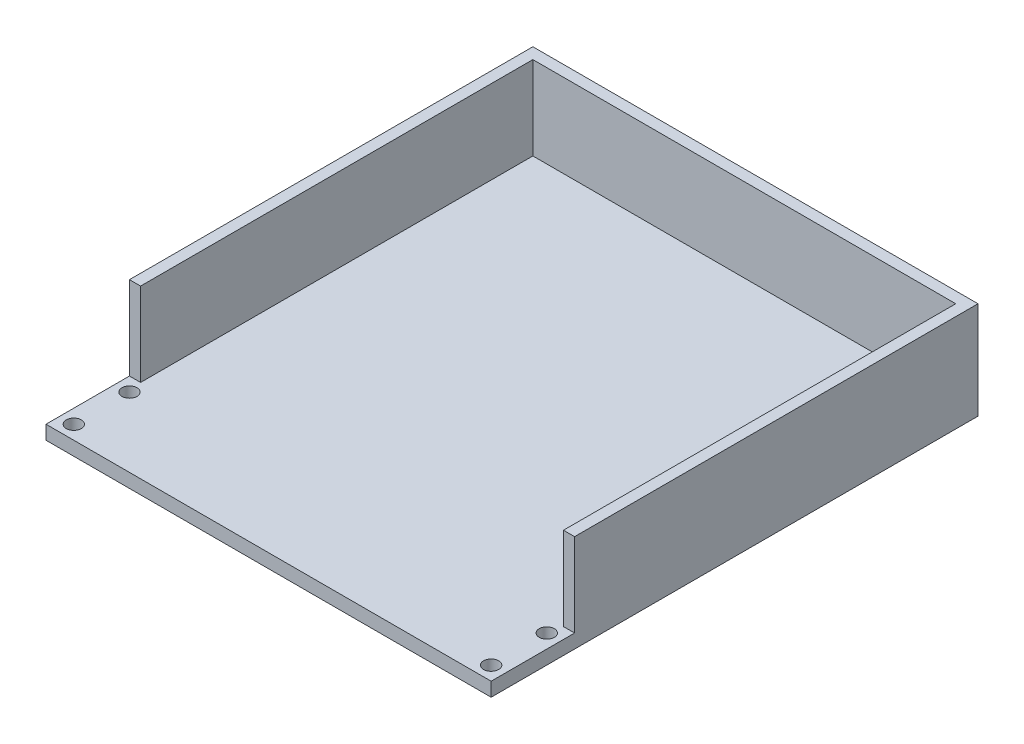
from build123d import *

# Parameters (mm, degrees)
SKETCH1_W             = 101.6
SKETCH1_H             = 101.6
SKETCH1_W_2           = 6.35
SKETCH1_H_2           = 9.525
BOSS_EXTRUDE1_DEPTH   = 3.175
F_8_32_TAPPED_HOLE1_D = 3.4544
BOSS_EXTRUDE2_DEPTH   = 19.05
SKETCH1_3_W           = 88.9
SKETCH1_3_H           = 9.525
BOSS_EXTRUDE3_DEPTH   = 3.175


with BuildPart() as part:
    # Sketch1 → Boss-Extrude1 (new body)
    with BuildSketch(Plane(origin=(0, 0, 0), x_dir=(1, 0, 0), z_dir=(0, 1, 0))):
        Rectangle(SKETCH1_W, SKETCH1_H)
        with Locations((-47.625, -55.5625)):
            Rectangle(SKETCH1_W_2, SKETCH1_H_2)
        with Locations((47.625, -55.5625)):
            Rectangle(SKETCH1_W_2, SKETCH1_H_2)
    extrude(amount=BOSS_EXTRUDE1_DEPTH)

    # #8-32 Tapped Hole1 (through all)
    with Locations(Plane(origin=(0, 0, 0), x_dir=(-1, 0, 0), z_dir=(0, -1, 0))):
        with Locations((-47.625, -57.15), (-47.625, -44.45), (47.625, -57.15), (47.625, -44.45)):
            Hole(F_8_32_TAPPED_HOLE1_D / 2)

    # Sketch8 → Boss-Extrude2 (add)
    with BuildSketch(Plane(origin=(0, 3.175, 0), x_dir=(1, 0, 0), z_dir=(0, 1, 0))):
        Polygon((-50.8, 50.8), (50.8, 50.8), (50.8, -41.275), (48.26, -41.275), (48.26, 48.26), (-48.26, 48.26), (-48.26, -41.275), (-50.8, -41.275), align=None)
    extrude(amount=BOSS_EXTRUDE2_DEPTH)

    # Sketch1<3> → Boss-Extrude3 (add)
    with BuildSketch(Plane(origin=(0, 0, 0), x_dir=(1, 0, 0), z_dir=(0, 1, 0))):
        with Locations((0, -55.5625)):
            Rectangle(SKETCH1_3_W, SKETCH1_3_H)
    extrude(amount=BOSS_EXTRUDE3_DEPTH)


solid = part.part
